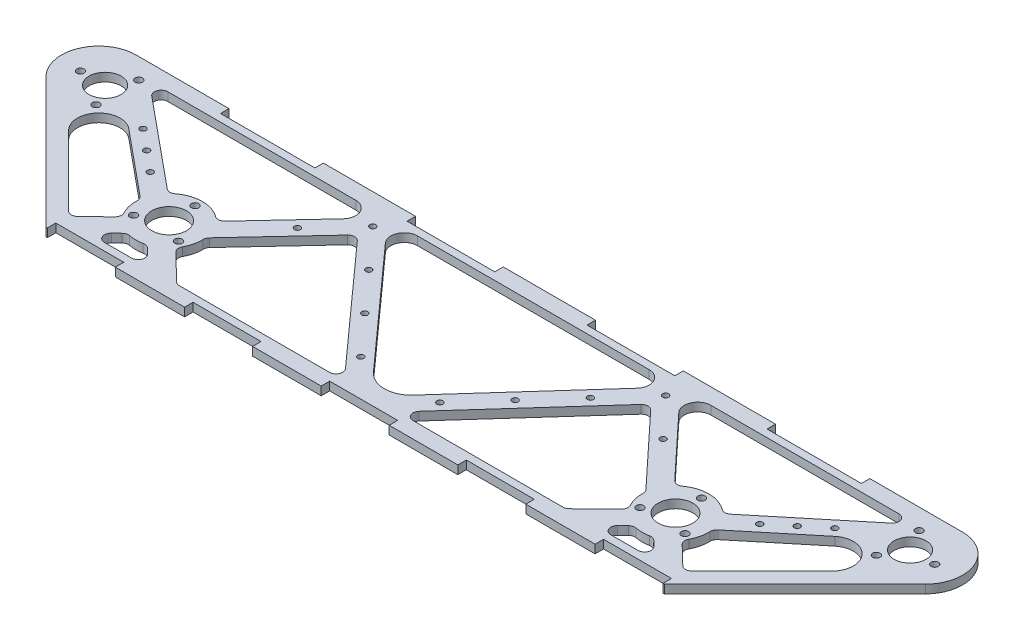
from build123d import *

# Parameters (mm, degrees)
BOSS_EXTRUDE1_DEPTH = 6.35
SKETCH2_R           = 12
SKETCH2_R_2         = 13
SKETCH2_R_3         = 2.75
CUT_EXTRUDE1_DEPTH  = 10
CUT_EXTRUDE4_DEPTH  = 10
SKETCH5_W           = 51
SKETCH5_H           = 6.36
CUT_EXTRUDE5_DEPTH  = 10
SKETCH6_W           = 70.8
SKETCH6_H           = 6.36
SKETCH6_W_2         = 65.79
SKETCH6_W_3         = 65.887878118
CUT_EXTRUDE6_DEPTH  = 10
SKETCH8_R           = 2.25
CUT_EXTRUDE7_DEPTH  = 6.35


with BuildPart() as part:
    # Sketch1 → Boss-Extrude1 (new body)
    with BuildSketch(Plane(origin=(0, 0, 0), x_dir=(1, 0, 0), z_dir=(0, 1, 0))):
        with BuildLine():
            Line((-232.01, 0), (232.01, 0))
            Line((232.01, 0), (329.893939059, 97.883939059))
            ThreePointArc((329.893939059, 97.883939059), (335.965743824, 128.408962941), (310.087878118, 145.7))
            Line((310.087878118, 145.7), (-310.087878118, 145.7))
            ThreePointArc((-310.087878118, 145.7), (-335.965743824, 128.408962941), (-329.893939059, 97.883939059))
            Line((-329.893939059, 97.883939059), (-232.01, 0))
        make_face()
    extrude(amount=BOSS_EXTRUDE1_DEPTH)

    # Sketch2 → Cut-Extrude1 (cut)
    with BuildSketch(Plane(origin=(0, 6.35, 0), x_dir=(1, 0, 0), z_dir=(0, 1, 0))):
        with Locations(Location((-302.0235, 114.35, 0), (0, 0, 270))):
            Circle(SKETCH2_R)
        with Locations(Location((-190, 50.35, 0), (0, 0, 270))):
            Circle(SKETCH2_R_2)
        with Locations(Location((-320.5235, 114.35, 0), (0, 0, 270))):
            Circle(SKETCH2_R_3)
        with Locations(Location((-292.7735, 130.37146997, 0), (0, 0, 270))):
            Circle(SKETCH2_R_3)
        with Locations(Location((-292.7735, 98.32853003, 0), (0, 0, 270))):
            Circle(SKETCH2_R_3)
        with Locations(Location((-190, 69.85, 0), (0, 0, 270))):
            Circle(SKETCH2_R_3)
        with Locations(Location((-173.112504626, 40.6, 0), (0, 0, 270))):
            Circle(SKETCH2_R_3)
        with Locations(Location((-206.887495374, 40.6, 0), (0, 0, 270))):
            Circle(SKETCH2_R_3)
        with Locations(Location((206.887495374, 40.6, 0), (0, 0, 90))):
            Circle(SKETCH2_R_3)
        with Locations(Location((173.112504626, 40.6, 0), (0, 0, 90))):
            Circle(SKETCH2_R_3)
        with Locations(Location((190, 69.85, 0), (0, 0, 90))):
            Circle(SKETCH2_R_3)
        with Locations(Location((292.7735, 98.32853003, 0), (0, 0, 90))):
            Circle(SKETCH2_R_3)
        with Locations(Location((292.7735, 130.37146997, 0), (0, 0, 90))):
            Circle(SKETCH2_R_3)
        with Locations(Location((320.5235, 114.35, 0), (0, 0, 90))):
            Circle(SKETCH2_R_3)
        with Locations(Location((190, 50.35, 0), (0, 0, 90))):
            Circle(SKETCH2_R_2)
        with Locations(Location((302.0235, 114.35, 0), (0, 0, 90))):
            Circle(SKETCH2_R)
    extrude(amount=-CUT_EXTRUDE1_DEPTH, mode=Mode.SUBTRACT)

    # Sketch3 → Cut-Extrude4 (cut)
    with BuildSketch(Plane(origin=(0, 6.35, 0), x_dir=(1, 0, 0), z_dir=(0, 1, 0))):
        with BuildLine():
            Line((-203.609801037, 20.59475985), (-199.510280391, 24.558045216))
            ThreePointArc((-199.510280391, 24.558045216), (-197.431061057, 25.764427124), (-195.029151341, 25.861071138))
            ThreePointArc((-195.029151341, 25.861071138), (-190, 25.35), (-184.970848659, 25.861071138))
            ThreePointArc((-184.970848659, 25.861071138), (-182.568938943, 25.764427124), (-180.489719609, 24.558045216))
            Line((-180.489719609, 24.558045216), (-176.390198963, 20.59475985))
            ThreePointArc((-176.390198963, 20.59475985), (-175.230101362, 15.125673354), (-179.865497744, 12))
            Line((-179.865497744, 12), (-200.134502256, 12))
            ThreePointArc((-200.134502256, 12), (-204.769898638, 15.125673354), (-203.609801037, 20.59475985))
        make_face()
        with BuildLine():
            Line((-216.797403535, 55.371430206), (-264.933334447, 95.044364046))
            ThreePointArc((-264.933334447, 95.044364046), (-286.953449794, 93.454792772), (-286.423184833, 71.383747582))
            Line((-286.423184833, 71.383747582), (-233.976968513, 18.937531261))
            ThreePointArc((-233.976968513, 18.937531261), (-230.483671979, 17.47324357), (-226.966135825, 18.878305318))
            Line((-226.966135825, 18.878305318), (-212.905914401, 32.47127743))
            ThreePointArc((-212.905914401, 32.47127743), (-211.439637745, 35.303913805), (-211.984344319, 38.446697733))
            ThreePointArc((-211.984344319, 38.446697733), (-214.348839226, 44.681311584), (-214.981206562, 51.319184556))
            ThreePointArc((-214.981206562, 51.319184556), (-215.414763854, 53.557994458), (-216.797403535, 55.371430206))
        make_face()
        with BuildLine():
            Line((-211.377331664, 70.342350872), (-277.502304442, 124.841591261))
            ThreePointArc((-277.502304442, 124.841591261), (-279.0282161, 130.389372118), (-274.322260103, 133.7))
            Line((-274.322260103, 133.7), (-133.275756536, 133.7))
            ThreePointArc((-133.275756536, 133.7), (-124.104559069, 127.68611804), (-125.964261402, 116.877827405))
            Line((-125.964261402, 116.877827405), (-168.6307126, 71.151111177))
            ThreePointArc((-168.6307126, 71.151111177), (-171.816187655, 69.584362226), (-175.238716805, 70.526831229))
            ThreePointArc((-175.238716805, 70.526831229), (-190.251609046, 75.348733826), (-205.164406104, 70.225633009))
            ThreePointArc((-205.164406104, 70.225633009), (-208.291202237, 69.20164169), (-211.377331664, 70.342350872))
        make_face()
        with BuildLine():
            Line((-94.343169344, 117.017095293), (-14.878008559, 28.561296949))
            ThreePointArc((-14.878008559, 28.561296949), (0, 21.927106364), (14.878008559, 28.561296949))
            Line((14.878008559, 28.561296949), (94.343169344, 117.017095293))
            ThreePointArc((94.343169344, 117.017095293), (96.037320244, 127.772527036), (86.904165065, 133.7))
            Line((86.904165065, 133.7), (-86.904165065, 133.7))
            ThreePointArc((-86.904165065, 133.7), (-96.037320244, 127.772527036), (-94.343169344, 117.017095293))
        make_face()
        with BuildLine():
            Line((-167.094085599, 32.47127743), (-147.372666059, 13.40524015))
            ThreePointArc((-147.372666059, 13.40524015), (-145.771693923, 12.364603617), (-143.897367277, 12))
            Line((-143.897367277, 12), (-31.377119137, 12))
            ThreePointArc((-31.377119137, 12), (-26.810541547, 14.963736482), (-27.657616997, 20.341452354))
            Line((-27.657616997, 20.341452354), (-106.350402898, 107.937489812))
            ThreePointArc((-106.350402898, 107.937489812), (-110.022699287, 109.595814615), (-113.725652605, 108.007123756))
            Line((-113.725652605, 108.007123756), (-163.664516336, 54.486378849))
            ThreePointArc((-163.664516336, 54.486378849), (-164.682404097, 52.852124796), (-165.007307308, 50.95441046))
            ThreePointArc((-165.007307308, 50.95441046), (-165.693185709, 44.503738032), (-168.015655681, 38.446697733))
            ThreePointArc((-168.015655681, 38.446697733), (-168.560362255, 35.303913805), (-167.094085599, 32.47127743))
        make_face()
        with BuildLine():
            Line((143.897367277, 12), (31.377119137, 12))
            ThreePointArc((31.377119137, 12), (26.810541547, 14.963736482), (27.657616997, 20.341452354))
            Line((27.657616997, 20.341452354), (106.350402898, 107.937489812))
            ThreePointArc((106.350402898, 107.937489812), (110.022699287, 109.595814615), (113.725652605, 108.007123756))
            Line((113.725652605, 108.007123756), (163.664516336, 54.486378849))
            ThreePointArc((163.664516336, 54.486378849), (164.682404097, 52.852124796), (165.007307308, 50.95441046))
            ThreePointArc((165.007307308, 50.95441046), (165.693185709, 44.503738032), (168.015655681, 38.446697733))
            ThreePointArc((168.015655681, 38.446697733), (168.560362255, 35.303913805), (167.094085599, 32.47127743))
            Line((167.094085599, 32.47127743), (147.372666059, 13.40524015))
            ThreePointArc((147.372666059, 13.40524015), (145.771693923, 12.364603617), (143.897367277, 12))
        make_face()
        with BuildLine():
            Line((200.134502256, 12), (179.865497744, 12))
            ThreePointArc((179.865497744, 12), (175.230101362, 15.125673354), (176.390198963, 20.59475985))
            Line((176.390198963, 20.59475985), (180.489719609, 24.558045216))
            ThreePointArc((180.489719609, 24.558045216), (182.568938943, 25.764427124), (184.970848659, 25.861071138))
            ThreePointArc((184.970848659, 25.861071138), (190, 25.35), (195.029151341, 25.861071138))
            ThreePointArc((195.029151341, 25.861071138), (197.431061057, 25.764427124), (199.510280391, 24.558045216))
            Line((199.510280391, 24.558045216), (203.609801037, 20.59475985))
            ThreePointArc((203.609801037, 20.59475985), (204.769898638, 15.125673354), (200.134502256, 12))
        make_face()
        with BuildLine():
            Line((286.423184833, 71.383747582), (233.976968513, 18.937531261))
            ThreePointArc((233.976968513, 18.937531261), (230.483671979, 17.47324357), (226.966135825, 18.878305318))
            Line((226.966135825, 18.878305318), (212.905914401, 32.47127743))
            ThreePointArc((212.905914401, 32.47127743), (211.439637745, 35.303913805), (211.984344319, 38.446697733))
            ThreePointArc((211.984344319, 38.446697733), (214.348839226, 44.681311584), (214.981206562, 51.319184556))
            ThreePointArc((214.981206562, 51.319184556), (215.414763854, 53.557994458), (216.797403535, 55.371430206))
            Line((216.797403535, 55.371430206), (264.933334447, 95.044364046))
            ThreePointArc((264.933334447, 95.044364046), (286.953449794, 93.454792772), (286.423184833, 71.383747582))
        make_face()
        with BuildLine():
            Line((168.6307126, 71.151111177), (125.964261402, 116.877827405))
            ThreePointArc((125.964261402, 116.877827405), (124.104559069, 127.68611804), (133.275756536, 133.7))
            Line((133.275756536, 133.7), (274.322260103, 133.7))
            ThreePointArc((274.322260103, 133.7), (279.0282161, 130.389372118), (277.502304442, 124.841591261))
            Line((277.502304442, 124.841591261), (211.377331664, 70.342350872))
            ThreePointArc((211.377331664, 70.342350872), (208.291202237, 69.20164169), (205.164406104, 70.225633009))
            ThreePointArc((205.164406104, 70.225633009), (190.251609046, 75.348733826), (175.238716805, 70.526831229))
            ThreePointArc((175.238716805, 70.526831229), (171.816187655, 69.584362226), (168.6307126, 71.151111177))
        make_face()
    extrude(amount=-CUT_EXTRUDE4_DEPTH, mode=Mode.SUBTRACT)

    # Sketch5 → Cut-Extrude5 (cut)
    with BuildSketch(Plane(origin=(0, 6.35, 0), x_dir=(1, 0, 0), z_dir=(0, 1, 0))):
        with Locations((-205.51, 3.18)):
            Rectangle(SKETCH5_W, SKETCH5_H)
        with Locations((0, 3.18)):
            Rectangle(SKETCH5_W, SKETCH5_H)
        with Locations((-102.51, 3.18)):
            Rectangle(SKETCH5_W, SKETCH5_H)
        with Locations((102.51, 3.18)):
            Rectangle(SKETCH5_W, SKETCH5_H)
        with Locations((205.51, 3.18)):
            Rectangle(SKETCH5_W, SKETCH5_H)
    extrude(amount=-CUT_EXTRUDE5_DEPTH, mode=Mode.SUBTRACT)

    # Sketch6 → Cut-Extrude6 (cut)
    with BuildSketch(Plane(origin=(0, 6.35, 0), x_dir=(1, 0, 0), z_dir=(0, 1, 0))):
        with Locations((-204.99, 142.52)):
            Rectangle(SKETCH6_W, SKETCH6_H)
        with Locations((-67.495, 142.52)):
            Rectangle(SKETCH6_W_2, SKETCH6_H)
        with Locations((67.543939059, 142.52)):
            Rectangle(SKETCH6_W_3, SKETCH6_H)
        with Locations((205.087878118, 142.52)):
            Rectangle(SKETCH6_W, SKETCH6_H)
    extrude(amount=-CUT_EXTRUDE6_DEPTH, mode=Mode.SUBTRACT)

    # Sketch8 → Cut-Extrude7 (cut)
    with BuildSketch(Plane(origin=(0, 6.35, 0), x_dir=(1, 0, 0), z_dir=(0, 1, 0))):
        with Locations(Location((259.552919224, 100.328936625, 0), (0, 0, 270))):
            Circle(SKETCH8_R)
        with Locations(Location((244.119284267, 87.608759267, 0), (0, 0, 270))):
            Circle(SKETCH8_R)
        with Locations(Location((228.685649311, 74.888581908, 0), (0, 0, 270))):
            Circle(SKETCH8_R)
        with Locations(Location((137.183832822, 93.859963278, 0), (0, 0, 270))):
            Circle(SKETCH8_R)
        with Locations(Location((109.895142443, 123.105943813, 0), (0, 0, 270))):
            Circle(SKETCH8_R)
        with Locations(Location((83.163523613, 93.349926695, 0), (0, 0, 270))):
            Circle(SKETCH8_R)
        with Locations(Location((56.431904783, 63.593909576, 0), (0, 0, 270))):
            Circle(SKETCH8_R)
        with Locations(Location((29.700285953, 33.837892458, 0), (0, 0, 270))):
            Circle(SKETCH8_R)
        with Locations(Location((-29.700285954, 33.837892458, 0), (0, 0, 270))):
            Circle(SKETCH8_R)
        with Locations(Location((-56.431904783, 63.593909576, 0), (0, 0, 270))):
            Circle(SKETCH8_R)
        with Locations(Location((-83.163523613, 93.349926694, 0), (0, 0, 270))):
            Circle(SKETCH8_R)
        with Locations(Location((-109.895142443, 123.105943813, 0), (0, 0, 270))):
            Circle(SKETCH8_R)
        with Locations(Location((-137.183832822, 93.859963278, 0), (0, 0, 270))):
            Circle(SKETCH8_R)
        with Locations(Location((-228.685649311, 74.888581908, 0), (0, 0, 270))):
            Circle(SKETCH8_R)
        with Locations(Location((-244.119284268, 87.608759267, 0), (0, 0, 270))):
            Circle(SKETCH8_R)
        with Locations(Location((-259.552919224, 100.328936625, 0), (0, 0, 270))):
            Circle(SKETCH8_R)
    extrude(amount=-CUT_EXTRUDE7_DEPTH, mode=Mode.SUBTRACT)


solid = part.part
